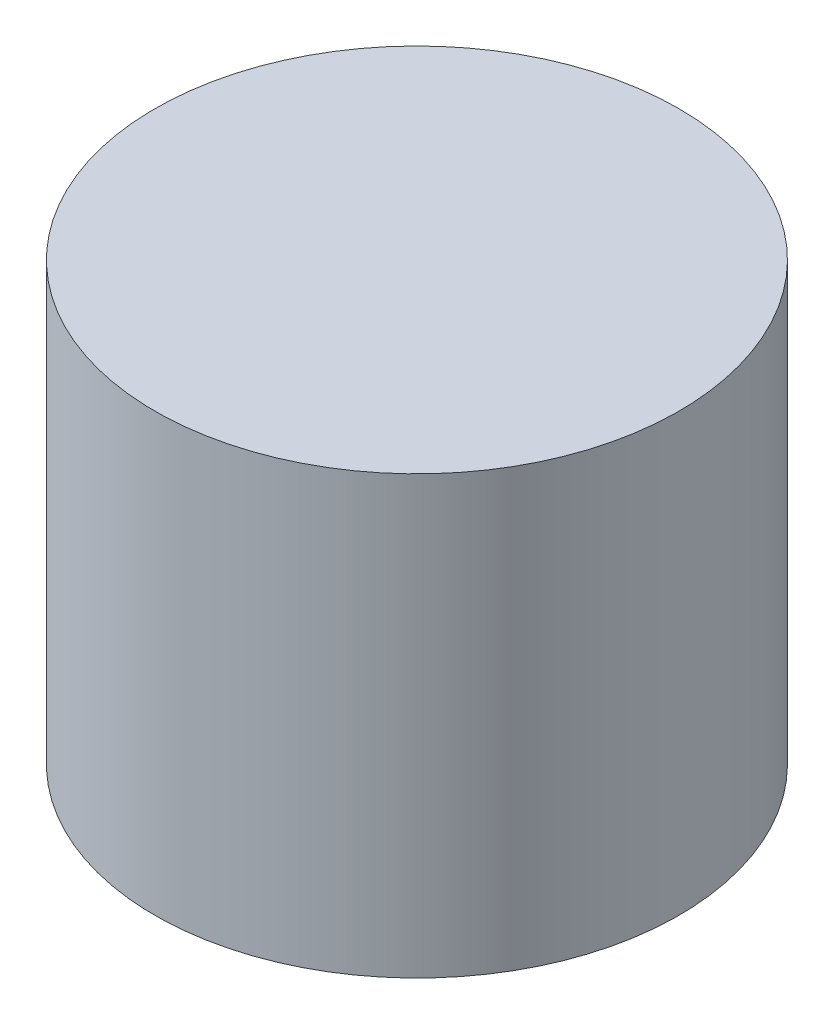
from build123d import *

# Parameters (mm, degrees)
RECONSTRUCTED_NOMINAL_AXIAL_PROFILE_W = 6
RECONSTRUCTED_NOMINAL_AXIAL_PROFILE_H = 10


with BuildPart() as part:
    # Reconstructed nominal axial profile → Native revolved geometry (revolve)
    with BuildSketch(Plane.XY, mode=Mode.PRIVATE) as native_revolved_geometry_sk:
        with Locations((3, 5)):
            Rectangle(RECONSTRUCTED_NOMINAL_AXIAL_PROFILE_W, RECONSTRUCTED_NOMINAL_AXIAL_PROFILE_H)
    revolve(native_revolved_geometry_sk.sketch.rotate(Axis((0, -500, 0), (0, 1, 0)), 90), axis=Axis((0, -500, 0), (0, 1, 0)))


solid = part.part
